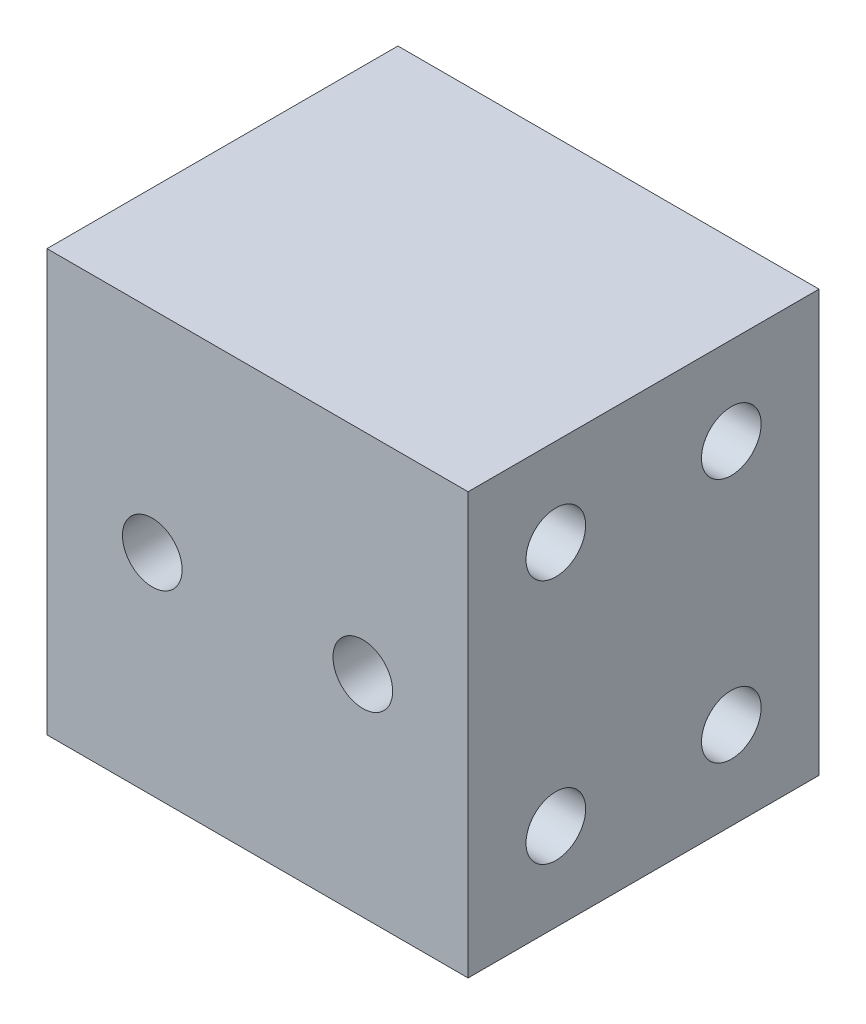
from build123d import *

# Parameters (mm, degrees)
SKETCH_1_W                                          = 24
SKETCH_1_H                                          = 24
SKETCH_1_R                                          = 1.7
WRIST_SPACER_W20_DEPTH                              = 20
GRIPPER_ADAPTER_M3_14X10_NOT_SG90_DIRECT_DEPTH      = 27.229754097
GRIPPER_ADAPTER_M3_14X10_NOT_SG90_DIRECT_DEPTH_BACK = 27.229754097
SKETCH_2_R                                          = 1.7


with BuildPart() as part:
    # 草图1 → Wrist_spacer_W20 (new body)
    with BuildSketch(Plane.XY):
        Rectangle(SKETCH_1_W, SKETCH_1_H)
        with Locations((-6, 0)):
            Circle(SKETCH_1_R, mode=Mode.SUBTRACT)
        with Locations((6, 0)):
            Circle(SKETCH_1_R, mode=Mode.SUBTRACT)
    extrude(amount=WRIST_SPACER_W20_DEPTH)

    # 草图2 → Gripper_adapter_M3_14x10_NOT_SG90_DIRECT (cut, two sides: drawn at the far end of the back side and taken through both)
    with BuildSketch(Plane(origin=(0, 0, 0), x_dir=(0, 0, -1), z_dir=(1, 0, 0)).offset(-GRIPPER_ADAPTER_M3_14X10_NOT_SG90_DIRECT_DEPTH_BACK)):
        with Locations((-5, -7)):
            Circle(SKETCH_2_R)
        with Locations((-15, -7)):
            Circle(SKETCH_2_R)
        with Locations((-5, 7)):
            Circle(SKETCH_2_R)
        with Locations((-15, 7)):
            Circle(SKETCH_2_R)
    extrude(amount=GRIPPER_ADAPTER_M3_14X10_NOT_SG90_DIRECT_DEPTH + GRIPPER_ADAPTER_M3_14X10_NOT_SG90_DIRECT_DEPTH_BACK, mode=Mode.SUBTRACT)


solid = part.part
